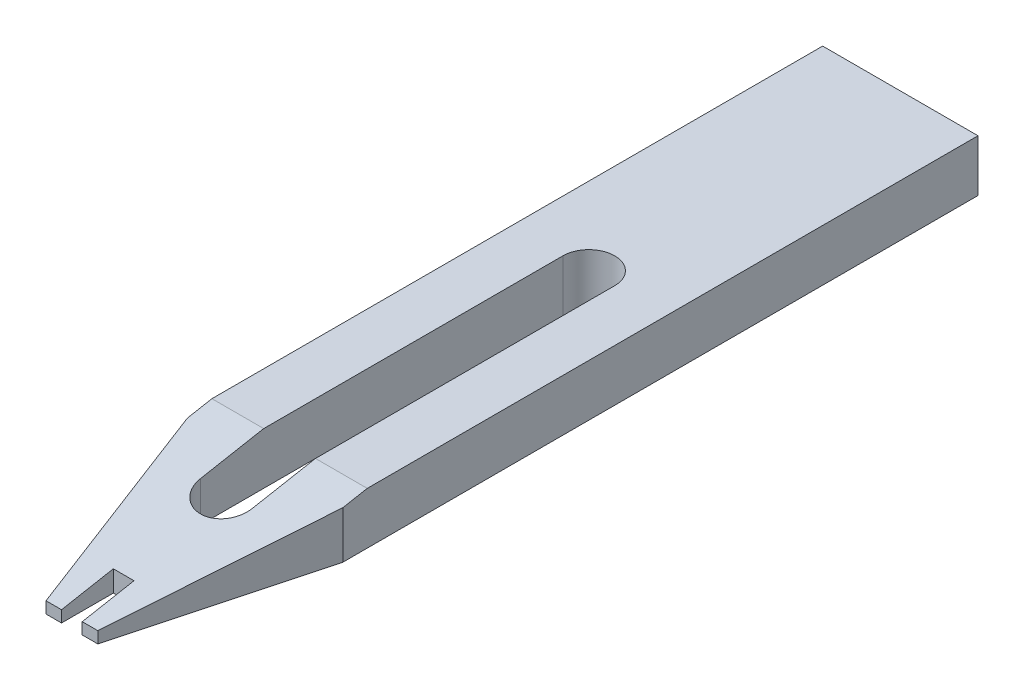
from build123d import *
from OCP.BRepFilletAPI import BRepFilletAPI_MakeChamfer

# Parameters (mm, degrees)
BOSS_EXTRUDE1_DEPTH     = 5
CHAMFER1_SIZE           = 5
CHAMFER1_SIZE2          = 18.660254038
CUT_EXTRUDE1_DEPTH      = 10
CUT_EXTRUDE1_DEPTH_BACK = 10


with BuildPart() as part:
    # Sketch1 → Boss-Extrude1 (new body)
    with BuildSketch(Plane(origin=(0, 0, 0), x_dir=(1, 0, 0), z_dir=(0, 1, 0))):
        Polygon((-7.5, 40), (7.5, 40), (7.5, -40), (1, -40), (1, -35), (-1, -35), (-1, -40), (-7.5, -40), align=None)
        with BuildLine():
            Line((-2.5, -25.078773429), (-2.5, 9.921226571))
            ThreePointArc((-2.5, 9.921226571), (0, 12.421226571), (2.5, 9.921226571))
            Line((2.5, 9.921226571), (2.5, -25.078773429))
            ThreePointArc((2.5, -25.078773429), (0, -27.578773429), (-2.5, -25.078773429))
        make_face(mode=Mode.SUBTRACT)
    extrude(amount=BOSS_EXTRUDE1_DEPTH)

    # Chamfer1: one chamfer whose edges measure the first distance from different faces: ONE call of the kernel's chamfer builder (chamfer() names one face for all edges)
    chamfer1_edges_1 = [part.edges().sort_by_distance(p)[0] for p in [
        (-7.5, 2.5, 40),
    ]]
    chamfer1_side_1 = [part.faces().sort_by_distance(p)[0] for p in [
        (-4.25, 2.5, 40),
    ]]
    chamfer1_edges_2 = [part.edges().sort_by_distance(p)[0] for p in [
        (7.5, 2.5, 40),
    ]]
    chamfer1_side_2 = [part.faces().sort_by_distance(p)[0] for p in [
        (4.25, 2.5, 40),
    ]]
    chamfer1 = BRepFilletAPI_MakeChamfer(part.part.solid().wrapped)
    for e in chamfer1_edges_1:
        chamfer1.Add(CHAMFER1_SIZE, CHAMFER1_SIZE2, e.wrapped, chamfer1_side_1[0].wrapped)  # the first distance lies on this face
    for e in chamfer1_edges_2:
        chamfer1.Add(CHAMFER1_SIZE, CHAMFER1_SIZE2, e.wrapped, chamfer1_side_2[0].wrapped)  # the first distance lies on this face
    add(Compound.cast(chamfer1.Shape()), mode=Mode.REPLACE)

    # Sketch2 → Cut-Extrude1 (cut, two sides: drawn at the far end of the back side and taken through both)
    with BuildSketch(Plane(origin=(0, 0, 0), x_dir=(0, 0, -1), z_dir=(1, 0, 0)).offset(-CUT_EXTRUDE1_DEPTH_BACK)):
        Polygon((-42.19528089, 0.706295209), (-15.143740131, 5.709375865), (-42.19528089, 5.709375865), align=None)
    extrude(amount=CUT_EXTRUDE1_DEPTH + CUT_EXTRUDE1_DEPTH_BACK, mode=Mode.SUBTRACT)


solid = part.part
